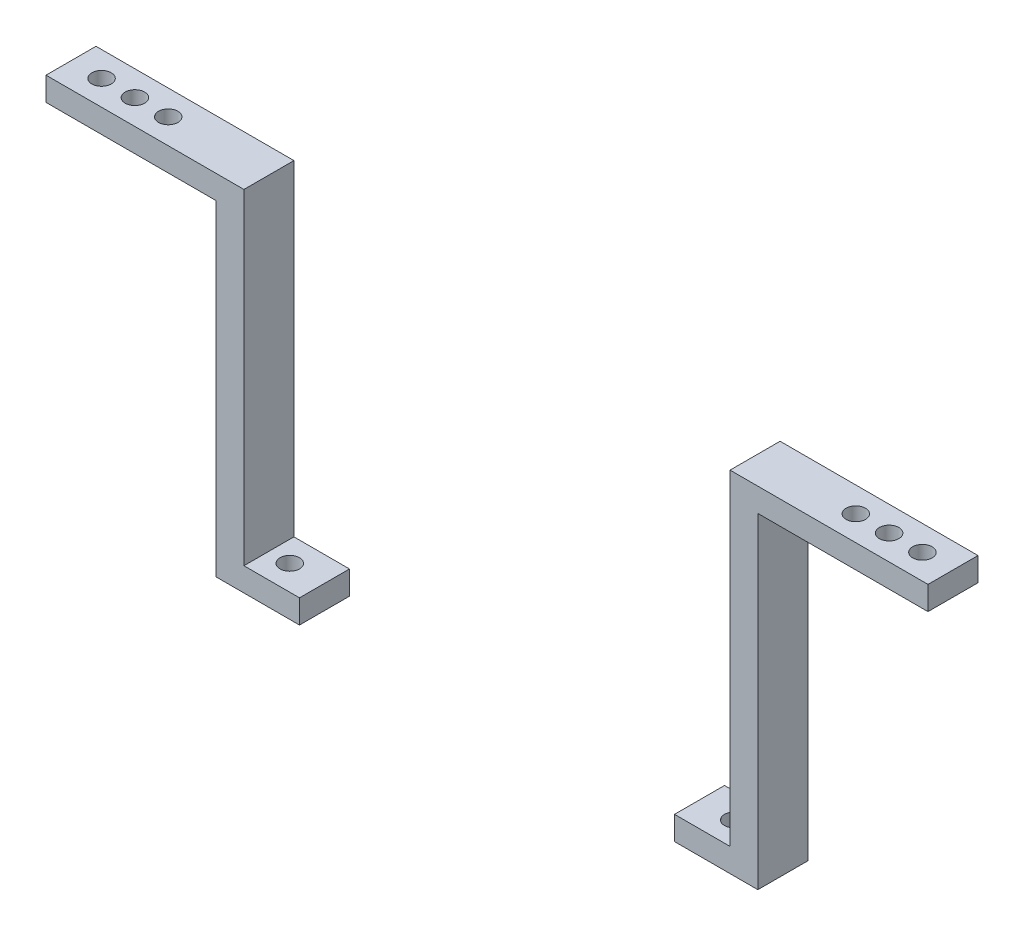
from build123d import *

# Parameters (mm, degrees)
SKETCH1_W             = 15.24
SKETCH1_H             = 9.144
SKETCH1_R             = 1.778
BOSS_EXTRUDE1_DEPTH   = 4.318
BOSS_EXTRUDE1_2_DEPTH = 4.318
SKETCH2_W             = 5.08
SKETCH2_H             = 9.144
BOSS_EXTRUDE2_DEPTH   = 55.276
SKETCH3_W             = 36.195
SKETCH3_H             = 9.144
BOSS_EXTRUDE3_DEPTH   = 4.318
SKETCH4_R             = 1.778
CUT_EXTRUDE1_DEPTH    = 104.001276463
SKETCH5_R             = 1.778
CUT_EXTRUDE2_DEPTH    = 104.001276463


with BuildPart() as part:
    # Sketch1 → Boss-Extrude1 (new body)
    with BuildSketch(Plane(origin=(0, 0, 0), x_dir=(1, 0, 0), z_dir=(0, 1, 0))):
        with Locations((-41.91, 0)):
            Rectangle(SKETCH1_W, SKETCH1_H)
        with Locations(Location((-40.64, 0, 0), (0, 0, 270))):
            Circle(SKETCH1_R, mode=Mode.SUBTRACT)
    extrude(amount=BOSS_EXTRUDE1_DEPTH)



with BuildPart() as body_2:
    # Sketch1 → Boss-Extrude1 2 (new body)
    with BuildSketch(Plane(origin=(0, 0, 0), x_dir=(1, 0, 0), z_dir=(0, 1, 0))):
        with Locations((41.91, 0)):
            Rectangle(SKETCH1_W, SKETCH1_H)
        with Locations(Location((40.64, 0, 0), (0, 0, 270))):
            Circle(SKETCH1_R, mode=Mode.SUBTRACT)
    extrude(amount=BOSS_EXTRUDE1_2_DEPTH)


with BuildPart() as part_1:
    add(part.part)

    add(body_2.part)  # Boss-Extrude2 merges body 2
    # Sketch2 → Boss-Extrude2 (add)
    with BuildSketch(Plane(origin=(0, 4.318, 0), x_dir=(1, 0, 0), z_dir=(0, 1, 0))):
        with Locations((-46.99, 0)):
            Rectangle(SKETCH2_W, SKETCH2_H)
        with Locations((46.99, 0)):
            Rectangle(SKETCH2_W, SKETCH2_H)
    extrude(amount=BOSS_EXTRUDE2_DEPTH)

    # Sketch3 → Boss-Extrude3 (add)
    with BuildSketch(Plane(origin=(0, 59.594, 0), x_dir=(1, 0, 0), z_dir=(0, 1, 0))):
        with Locations((-62.5475, 0)):
            Rectangle(SKETCH3_W, SKETCH3_H)
        with Locations((62.5475, 0)):
            Rectangle(SKETCH3_W, SKETCH3_H)
    extrude(amount=BOSS_EXTRUDE3_DEPTH)

    # Sketch4 → Cut-Extrude1 (cut, through all)
    with BuildSketch(Plane(origin=(0, 63.912, 0), x_dir=(1, 0, 0), z_dir=(0, 1, 0))):
        with Locations(Location((-75.057, 0, 0), (0, 0, 270))):
            Circle(SKETCH4_R)
        with Locations(Location((75.057, 0, 0), (0, 0, 270))):
            Circle(SKETCH4_R)
    extrude(amount=-CUT_EXTRUDE1_DEPTH, mode=Mode.SUBTRACT)

    # Sketch5 → Cut-Extrude2 (cut, through all)
    with BuildSketch(Plane(origin=(0, 63.912, 0), x_dir=(1, 0, 0), z_dir=(0, 1, 0))):
        with Locations(Location((-68.961, 0, 0), (0, 0, 270))):
            Circle(SKETCH5_R)
        with Locations(Location((-62.865, 0, 0), (0, 0, 270))):
            Circle(SKETCH5_R)
        with Locations(Location((62.865, 0, 0), (0, 0, 270))):
            Circle(SKETCH5_R)
        with Locations(Location((68.961, 0, 0), (0, 0, 270))):
            Circle(SKETCH5_R)
    extrude(amount=-CUT_EXTRUDE2_DEPTH, mode=Mode.SUBTRACT)


solid = part_1.part
